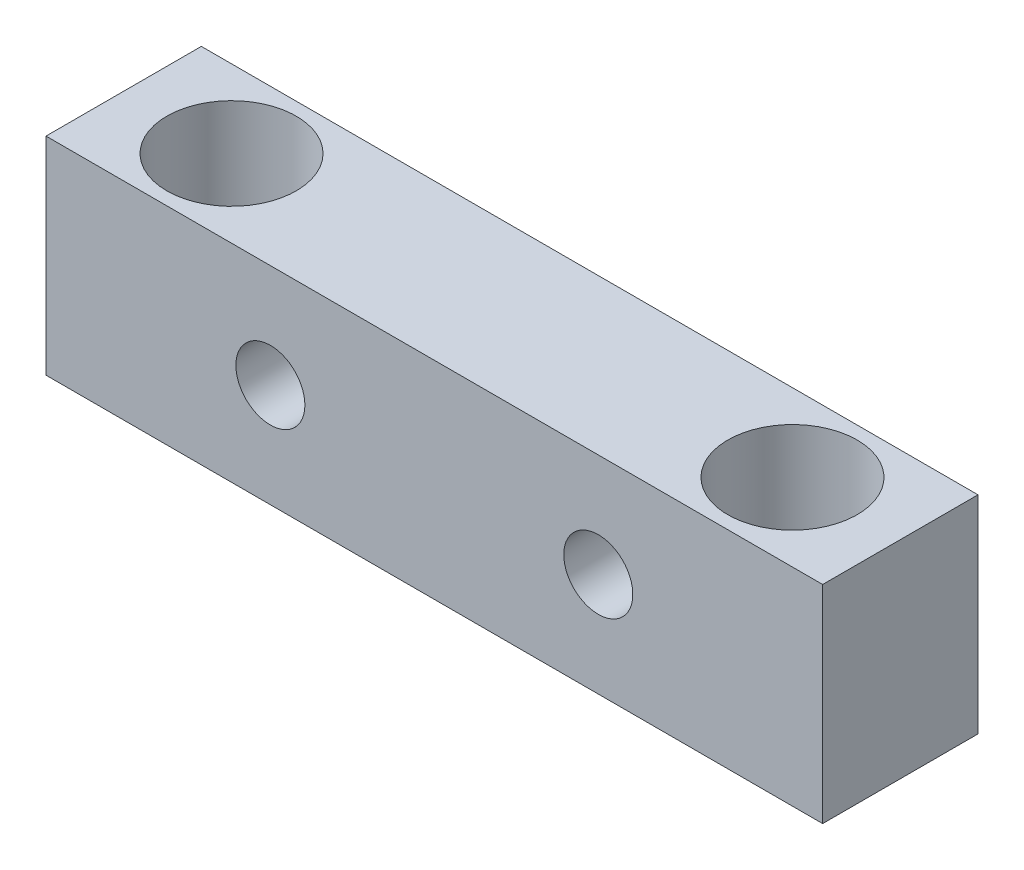
from build123d import *

# Parameters (mm, degrees)
SKETCH1_W           = 90
SKETCH1_H           = 24
SKETCH1_R           = 4
BOSS_EXTRUDE1_DEPTH = 9
SKETCH2_R           = 7.5
CUT_EXTRUDE3_DEPTH  = 52.788029505


with BuildPart() as part:
    # Sketch1 → Boss-Extrude1 (new, symmetric)
    with BuildSketch(Plane.XY):
        Rectangle(SKETCH1_W, SKETCH1_H)
        with Locations((-19, 0)):
            Circle(SKETCH1_R, mode=Mode.SUBTRACT)
        with Locations(Location((19, 0, 0), (0, 0, 180))):
            Circle(SKETCH1_R, mode=Mode.SUBTRACT)
    extrude(amount=BOSS_EXTRUDE1_DEPTH, both=True)

    # Sketch2 → Cut-Extrude3 (cut, through all)
    with BuildSketch(Plane(origin=(0, 12, 0), x_dir=(1, 0, 0), z_dir=(0, 1, 0))):
        with Locations(Location((-32.5, 0, 0), (0, 0, 270))):
            Circle(SKETCH2_R)
        with Locations(Location((32.5, 0, 0), (0, 0, 90))):
            Circle(SKETCH2_R)
    extrude(amount=-CUT_EXTRUDE3_DEPTH, mode=Mode.SUBTRACT)


solid = part.part
